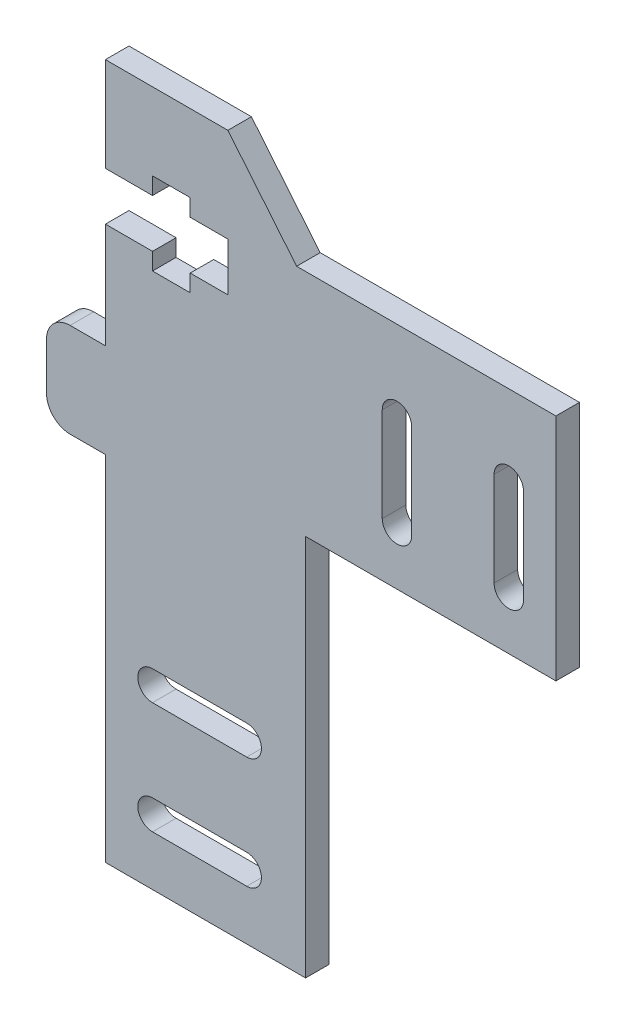
from build123d import *

# Parameters (mm, degrees)
EXTRUDE_1_DEPTH = 2
FILLET_1_R      = 2
SKETCH_5_W      = 25.102776666
SKETCH_5_H      = 0.92
EXTRUDE_2_DEPTH = 2


with BuildPart() as part:
    # 草图1 → 凸台-拉伸1 (new body)
    with BuildSketch(Plane.XY):
        Polygon((-8.301811847, -11.701358885), (-3.301811847, -11.701358885), (-3.301811847, -41.701358885), (13.698188153, -41.701358885), (13.698188153, -9.223166137), (34.95900929, -9.223166137), (34.95900929, 9.348641115), (13.698188153, 9.348641115), (7.098188153, 17.348641115), (-3.301811847, 17.348641115), (-3.301811847, 9.348641115), (0.698188153, 9.348641115), (0.698188153, 10.798641115), (3.898188153, 10.798641115), (3.898188153, 9.348641115), (7.098188153, 9.348641115), (7.098188153, 5.248641115), (3.898188153, 5.248641115), (3.898188153, 3.798641115), (0.698188153, 3.798641115), (0.698188153, 5.248641115), (-3.301811847, 5.248641115), (-3.301811847, -3.701358885), (-8.301811847, -3.701358885), align=None)
        with BuildLine():
            Line((0.698188153, -25.451358885), (8.698188153, -25.451358885))
            ThreePointArc((8.698188153, -25.451358885), (9.948188153, -26.701358885), (8.698188153, -27.951358885))
            Line((8.698188153, -27.951358885), (0.698188153, -27.951358885))
            ThreePointArc((0.698188153, -27.951358885), (-0.551811847, -26.701358885), (0.698188153, -25.451358885))
        make_face(mode=Mode.SUBTRACT)
        with BuildLine():
            Line((8.698188153, -37.451358885), (0.698188153, -37.451358885))
            ThreePointArc((0.698188153, -37.451358885), (-0.551811847, -36.201358885), (0.698188153, -34.951358885))
            Line((0.698188153, -34.951358885), (8.698188153, -34.951358885))
            ThreePointArc((8.698188153, -34.951358885), (9.948188153, -36.201358885), (8.698188153, -37.451358885))
        make_face(mode=Mode.SUBTRACT)
        with BuildLine():
            Line((32.20900929, 3.348641115), (32.20900929, -4.651358885))
            ThreePointArc((32.20900929, -4.651358885), (30.95900929, -5.901358885), (29.70900929, -4.651358885))
            Line((29.70900929, -4.651358885), (29.70900929, 3.348641115))
            ThreePointArc((29.70900929, 3.348641115), (30.95900929, 4.598641115), (32.20900929, 3.348641115))
        make_face(mode=Mode.SUBTRACT)
        with BuildLine():
            Line((22.70900929, 3.348641115), (22.70900929, -4.651358885))
            ThreePointArc((22.70900929, -4.651358885), (21.45900929, -5.901358885), (20.20900929, -4.651358885))
            Line((20.20900929, -4.651358885), (20.20900929, 3.348641115))
            ThreePointArc((20.20900929, 3.348641115), (21.45900929, 4.598641115), (22.70900929, 3.348641115))
        make_face(mode=Mode.SUBTRACT)
    extrude(amount=EXTRUDE_1_DEPTH)

    # 圆角1
    fillet_1_edges = [part.edges().sort_by_distance(p)[0] for p in [
        (-8.301811847, -3.701358885, 1),
        (-8.301811847, -11.701358885, 1),
    ]]
    fillet(fillet_1_edges, radius=FILLET_1_R)

    # 草图5 → 凸台-拉伸2 (add)
    with BuildSketch(Plane.XY.offset(2)):
        with Locations((22.407620957, 9.808641115)):
            Rectangle(SKETCH_5_W, SKETCH_5_H)
    extrude(amount=-EXTRUDE_2_DEPTH)


solid = part.part
